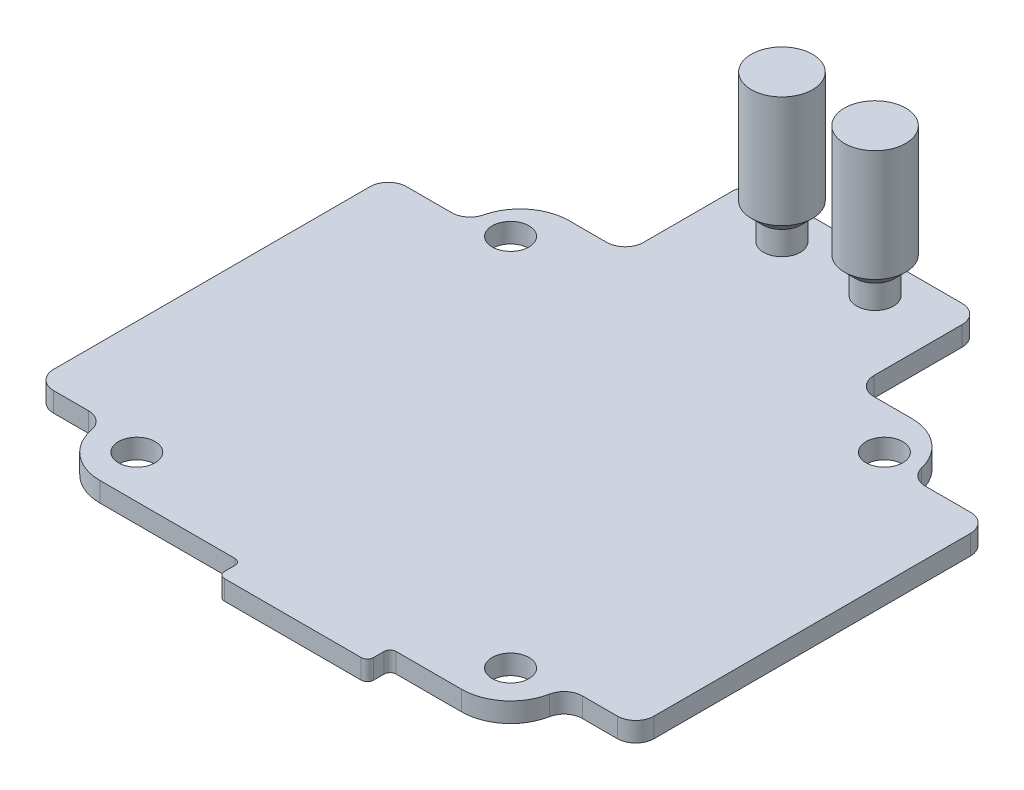
from build123d import *

# Parameters (mm, degrees)
SKETCH1_R           = 1.5
BOSS_EXTRUDE1_DEPTH = 1.6
FILLET1_R           = 4
FILLET2_R           = 1.5
FILLET3_R           = 0.5
SKETCH2_R           = 1.25
BOSS_EXTRUDE2_DEPTH = 1.5
SKETCH3_R           = 1.5
BOSS_EXTRUDE3_DEPTH = 2
SKETCH4_R           = 2.5
BOSS_EXTRUDE4_DEPTH = 10
CHAMFER1_SIZE       = 0.9


with BuildPart() as part:
    # Sketch1 → Boss-Extrude1 (new body)
    with BuildSketch(Plane(origin=(0, 0, 0), x_dir=(1, 0, 0), z_dir=(0, 1, 0))):
        Polygon((3.682892501, 9.884360961), (9.432892501, 9.884360961), (9.432892501, 5.424302162), (24.937092609, 5.424302162), (24.937092609, 3.570771232), (37.100889333, 3.570771232), (37.100889333, 5.424302162), (46.932892501, 5.424302162), (46.932892501, 9.884360961), (52.682892501, 9.884360961), (52.682892501, 38.695125613), (46.161283606, 38.695125613), (46.161283606, 42.924302162), (37.585453381, 42.924302162), (37.585453381, 53.114107514), (18.780331621, 53.114107514), (18.780331621, 42.924302162), (10.204501396, 42.924302162), (10.204501396, 38.695125613), (3.682892501, 38.695125613), align=None)
        with Locations(Location((12.932892501, 8.924302162, 0), (0, 0, 270))):
            Circle(SKETCH1_R, mode=Mode.SUBTRACT)
        with Locations(Location((43.432892501, 8.924302162, 0), (0, 0, 270))):
            Circle(SKETCH1_R, mode=Mode.SUBTRACT)
        with Locations(Location((43.432892501, 39.424302162, 0), (0, 0, 270))):
            Circle(SKETCH1_R, mode=Mode.SUBTRACT)
        with Locations(Location((12.932892501, 39.424302162, 0), (0, 0, 270))):
            Circle(SKETCH1_R, mode=Mode.SUBTRACT)
    extrude(amount=BOSS_EXTRUDE1_DEPTH)

    # Fillet1
    fillet1_edges = [part.edges().sort_by_distance(p)[0] for p in [
        (46.161283606, 0.8, -42.924302162),
        (46.932892501, 0.8, -5.424302162),
        (9.432892501, 0.8, -5.424302162),
        (10.204501396, 0.8, -42.924302162),
    ]]
    fillet(fillet1_edges, radius=FILLET1_R)

    # Fillet2
    fillet2_edges = [part.edges().sort_by_distance(p)[0] for p in [
        (52.682892501, 0.8, -9.884360961),
        (52.682892501, 0.8, -38.695125613),
        (37.585453381, 0.8, -42.924302162),
        (37.585453381, 0.8, -53.114107514),
        (18.780331621, 0.8, -53.114107514),
        (18.780331621, 0.8, -42.924302162),
        (3.682892501, 0.8, -38.695125613),
        (46.932892501, 0.8, -9.884360961),
        (9.432892501, 0.8, -9.884360961),
        (46.161283606, 0.8, -38.695125613),
        (10.204501396, 0.8, -38.695125613),
        (3.682892501, 0.8, -9.884360961),
    ]]
    fillet(fillet2_edges, radius=FILLET2_R)

    # Fillet3
    fillet3_edges = [part.edges().sort_by_distance(p)[0] for p in [
        (37.100889333, 0.8, -5.424302162),
        (37.100889333, 0.8, -3.570771232),
        (24.937092609, 0.8, -3.570771232),
        (24.937092609, 0.8, -5.424302162),
    ]]
    fillet(fillet3_edges, radius=FILLET3_R)

    # Sketch2 → Boss-Extrude2 (add)
    with BuildSketch(Plane(origin=(0, 1.6, 0), x_dir=(1, 0, 0), z_dir=(0, 1, 0))):
        with Locations(Location((31.982892501, 50.114107514, 0), (0, 0, 270))):
            Circle(SKETCH2_R)
        with Locations(Location((24.382892501, 50.114107514, 0), (0, 0, 90))):
            Circle(SKETCH2_R)
    extrude(amount=BOSS_EXTRUDE2_DEPTH)

    # Sketch3 → Boss-Extrude3 (add)
    with BuildSketch(Plane(origin=(0, 1.6, 0), x_dir=(1, 0, 0), z_dir=(0, 1, 0))):
        with Locations(Location((31.982892501, 50.114107514, 0), (0, 0, 270))):
            Circle(SKETCH3_R)
        with Locations(Location((24.382892501, 50.114107514, 0), (0, 0, 270))):
            Circle(SKETCH3_R)
    extrude(amount=BOSS_EXTRUDE3_DEPTH)

    # Sketch4 → Boss-Extrude4 (add)
    with BuildSketch(Plane(origin=(0, 3.6, 0), x_dir=(1, 0, 0), z_dir=(0, 1, 0))):
        with Locations(Location((31.982892501, 50.114107514, 0), (0, 0, 270))):
            Circle(SKETCH4_R)
        with Locations(Location((24.382892501, 50.114107514, 0), (0, 0, 270))):
            Circle(SKETCH4_R)
    extrude(amount=BOSS_EXTRUDE4_DEPTH)

    # Chamfer1
    chamfer1_edges = [part.edges().sort_by_distance(p)[0] for p in [
        (31.982892501, 3.6, -52.614107514),
        (24.382892501, 3.6, -52.614107514),
    ]]
    chamfer(chamfer1_edges, length=CHAMFER1_SIZE)


solid = part.part
